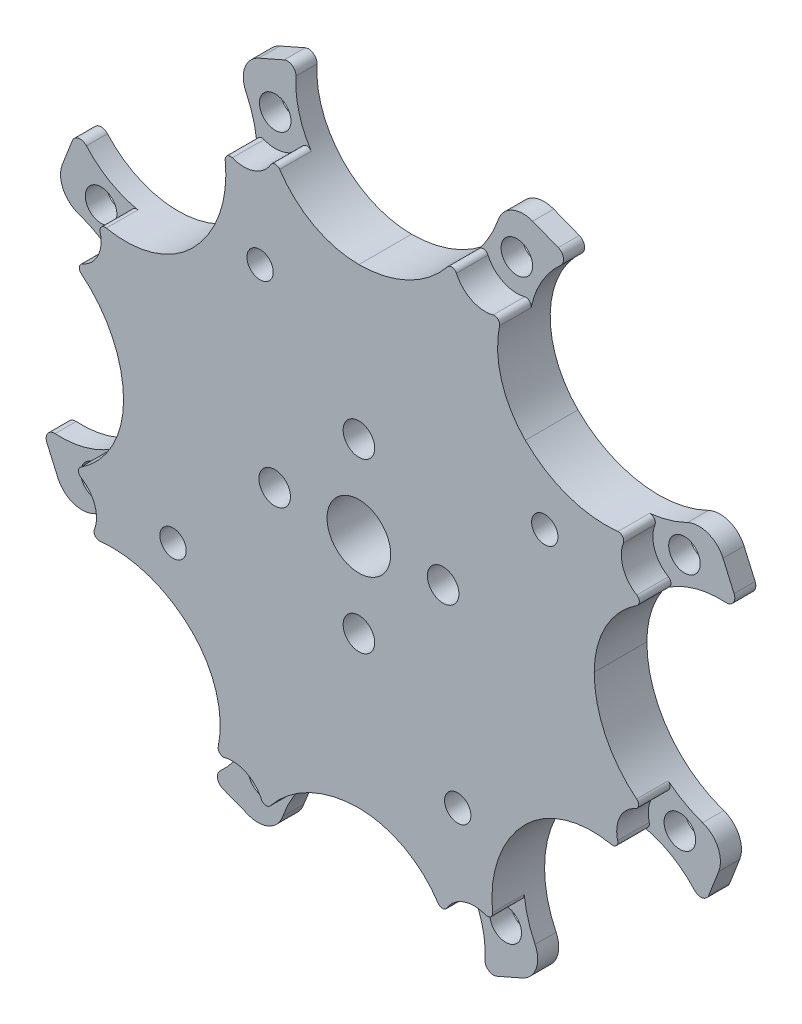
from build123d import *

# Parameters (mm, degrees)
SKETCH_1_R          = 3.025
SKETCH_1_R_2        = 1.5
EXTRUDE_1_DEPTH     = 5
SKETCH_3_R          = 1.5
CUT_EXTRUDE_3_DEPTH = 10
CUT_EXTRUDE_START   = -3
CUT_EXTRUDE_5_DEPTH = 3
FILLET_1_R          = 0.5
HOLE_WIZARD_M3_1_D  = 2.5


with BuildPart() as part:
    # 草图1 → 凸台-拉伸1 (new body)
    with BuildSketch(Plane.XY):
        with BuildLine():
            Line((15.936762996, 30.229618981), (13.50337588, 31.175538906))
            ThreePointArc((13.50337588, 31.175538906), (11.545587701, 31.113280948), (10.233613318, 29.658793469))
            ThreePointArc((10.233613318, 29.658793469), (6.285609854, 24.369935979), (0, 22.357511157))
            ThreePointArc((0, 22.357511157), (-6.541634269, 25.176328334), (-8.985563862, 31.867062025))
            ThreePointArc((-8.985563862, 31.867062025), (-9.328351981, 32.569720668), (-10.106575389, 32.644561759))
            Line((-10.106575389, 32.644561759), (-12.496106314, 31.592763621))
            ThreePointArc((-12.496106314, 31.592763621), (-13.836448588, 30.1643753), (-13.73567661, 28.208191357))
            ThreePointArc((-13.73567661, 28.208191357), (-12.787549636, 21.67674434), (-15.80914775, 15.80914775))
            ThreePointArc((-15.80914775, 15.80914775), (-22.427986442, 13.176718539), (-28.887168794, 16.179662515))
            ThreePointArc((-28.887168794, 16.179662515), (-29.626411288, 16.434129403), (-30.229618981, 15.936762996))
            Line((-30.229618981, 15.936762996), (-31.175538906, 13.50337588))
            ThreePointArc((-31.175538906, 13.50337588), (-31.113280948, 11.545587701), (-29.658793469, 10.233613318))
            ThreePointArc((-29.658793469, 10.233613318), (-24.369935979, 6.285609854), (-22.357511157, 0))
            ThreePointArc((-22.357511157, 0), (-25.176328334, -6.541634269), (-31.867062025, -8.985563862))
            ThreePointArc((-31.867062025, -8.985563862), (-32.569720668, -9.328351981), (-32.644561759, -10.106575389))
            Line((-32.644561759, -10.106575389), (-31.592763621, -12.496106314))
            ThreePointArc((-31.592763621, -12.496106314), (-30.1643753, -13.836448588), (-28.208191357, -13.73567661))
            ThreePointArc((-28.208191357, -13.73567661), (-21.67674434, -12.787549636), (-15.80914775, -15.80914775))
            ThreePointArc((-15.80914775, -15.80914775), (-13.176718539, -22.427986442), (-16.179662515, -28.887168794))
            ThreePointArc((-16.179662515, -28.887168794), (-16.434129403, -29.626411288), (-15.936762996, -30.229618981))
            Line((-15.936762996, -30.229618981), (-13.50337588, -31.175538906))
            ThreePointArc((-13.50337588, -31.175538906), (-11.545587701, -31.113280948), (-10.233613318, -29.658793469))
            ThreePointArc((-10.233613318, -29.658793469), (-6.285609854, -24.369935979), (0, -22.357511157))
            ThreePointArc((0, -22.357511157), (6.541634269, -25.176328334), (8.985563862, -31.867062025))
            ThreePointArc((8.985563862, -31.867062025), (9.328351981, -32.569720668), (10.106575389, -32.644561759))
            Line((10.106575389, -32.644561759), (12.496106314, -31.592763621))
            ThreePointArc((12.496106314, -31.592763621), (13.836448588, -30.1643753), (13.73567661, -28.208191357))
            ThreePointArc((13.73567661, -28.208191357), (12.787549636, -21.67674434), (15.80914775, -15.80914775))
            ThreePointArc((15.80914775, -15.80914775), (22.427986442, -13.176718539), (28.887168794, -16.179662515))
            ThreePointArc((28.887168794, -16.179662515), (29.626411288, -16.434129403), (30.229618981, -15.936762996))
            Line((30.229618981, -15.936762996), (31.175538906, -13.50337588))
            ThreePointArc((31.175538906, -13.50337588), (31.113280948, -11.545587701), (29.658793469, -10.233613318))
            ThreePointArc((29.658793469, -10.233613318), (24.369935979, -6.285609854), (22.357511157, 0))
            ThreePointArc((22.357511157, 0), (25.176328334, 6.541634269), (31.867062025, 8.985563862))
            ThreePointArc((31.867062025, 8.985563862), (32.569720668, 9.328351981), (32.644561759, 10.106575389))
            Line((32.644561759, 10.106575389), (31.592763621, 12.496106314))
            ThreePointArc((31.592763621, 12.496106314), (30.1643753, 13.836448588), (28.208191357, 13.73567661))
            ThreePointArc((28.208191357, 13.73567661), (21.67674434, 12.787549636), (15.80914775, 15.80914775))
            ThreePointArc((15.80914775, 15.80914775), (13.176718539, 22.427986442), (16.179662515, 28.887168794))
            ThreePointArc((16.179662515, 28.887168794), (16.434129403, 29.626411288), (15.936762996, 30.229618981))
        make_face()
        Circle(SKETCH_1_R, mode=Mode.SUBTRACT)
        with Locations((-8, 0)):
            Circle(SKETCH_1_R_2, mode=Mode.SUBTRACT)
        with Locations((0, 8)):
            Circle(SKETCH_1_R_2, mode=Mode.SUBTRACT)
        with Locations((8, 0)):
            Circle(SKETCH_1_R_2, mode=Mode.SUBTRACT)
        with Locations((0, -8)):
            Circle(SKETCH_1_R_2, mode=Mode.SUBTRACT)
    extrude(amount=EXTRUDE_1_DEPTH)

    # 草图3 → 切除-拉伸3 (cut)
    with BuildSketch(Plane.XY.offset(5)):
        with Locations((-10.95008804, 27.930191047)):
            Circle(SKETCH_3_R)
        with Locations((12.006745981, 27.492508997)):
            Circle(SKETCH_3_R)
        with Locations((27.930191047, 10.95008804)):
            Circle(SKETCH_3_R)
        with Locations((27.492508997, -12.006745981)):
            Circle(SKETCH_3_R)
        with Locations((10.95008804, -27.930191047)):
            Circle(SKETCH_3_R)
        with Locations((-12.006745981, -27.492508997)):
            Circle(SKETCH_3_R)
        with Locations((-27.930191047, -10.95008804)):
            Circle(SKETCH_3_R)
        with Locations((-27.492508997, 12.006745981)):
            Circle(SKETCH_3_R)
    extrude(amount=-CUT_EXTRUDE_3_DEPTH, mode=Mode.SUBTRACT)

    # 草图5 → 切除-拉伸5 (cut)
    with BuildSketch(Plane.XY.offset(5).offset(CUT_EXTRUDE_START)):
        with BuildLine():
            Line((15.936762996, 30.229618981), (13.50337588, 31.175538906))
            ThreePointArc((13.50337588, 31.175538906), (11.545587701, 31.113280948), (10.233613318, 29.658793469))
            ThreePointArc((10.233613318, 29.658793469), (9.705394279, 28.391351914), (9.020942987, 27.200994876))
            ThreePointArc((9.020942987, 27.200994876), (10.691803769, 24.796043351), (13.615595197, 24.960394426))
            ThreePointArc((13.615595197, 24.960394426), (14.637360817, 27.093728928), (16.179662515, 28.887168794))
            ThreePointArc((16.179662515, 28.887168794), (16.434129403, 29.626411288), (15.936762996, 30.229618981))
        make_face()
        with BuildLine():
            Line((32.644561759, 10.106575389), (31.592763621, 12.496106314))
            ThreePointArc((31.592763621, 12.496106314), (30.1643753, 13.836448588), (28.208191357, 13.73567661))
            ThreePointArc((28.208191357, 13.73567661), (26.938467574, 13.212967357), (25.612777891, 12.855237973))
            ThreePointArc((25.612777891, 12.855237973), (25.093697348, 9.973203452), (27.277343853, 8.021984466))
            ThreePointArc((27.277343853, 8.021984466), (29.508336545, 8.80798236), (31.867062025, 8.985563862))
            ThreePointArc((31.867062025, 8.985563862), (32.569720668, 9.328351981), (32.644561759, 10.106575389))
        make_face()
        with BuildLine():
            Line((30.229618981, -15.936762996), (31.175538906, -13.50337588))
            ThreePointArc((31.175538906, -13.50337588), (31.113280948, -11.545587701), (29.658793469, -10.233613318))
            ThreePointArc((29.658793469, -10.233613318), (28.391351914, -9.705394279), (27.200994876, -9.020942987))
            ThreePointArc((27.200994876, -9.020942987), (24.796043351, -10.691803769), (24.960394426, -13.615595197))
            ThreePointArc((24.960394426, -13.615595197), (27.093728928, -14.637360817), (28.887168794, -16.179662515))
            ThreePointArc((28.887168794, -16.179662515), (29.626411288, -16.434129403), (30.229618981, -15.936762996))
        make_face()
        with BuildLine():
            Line((10.106575389, -32.644561759), (12.496106314, -31.592763621))
            ThreePointArc((12.496106314, -31.592763621), (13.836448588, -30.1643753), (13.73567661, -28.208191357))
            ThreePointArc((13.73567661, -28.208191357), (13.212967357, -26.938467574), (12.855237973, -25.612777891))
            ThreePointArc((12.855237973, -25.612777891), (9.973203452, -25.093697348), (8.021984466, -27.277343853))
            ThreePointArc((8.021984466, -27.277343853), (8.80798236, -29.508336545), (8.985563862, -31.867062025))
            ThreePointArc((8.985563862, -31.867062025), (9.328351981, -32.569720668), (10.106575389, -32.644561759))
        make_face()
        with BuildLine():
            Line((-15.936762996, -30.229618981), (-13.50337588, -31.175538906))
            ThreePointArc((-13.50337588, -31.175538906), (-11.545587701, -31.113280948), (-10.233613318, -29.658793469))
            ThreePointArc((-10.233613318, -29.658793469), (-9.705394279, -28.391351914), (-9.020942987, -27.200994876))
            ThreePointArc((-9.020942987, -27.200994876), (-10.691803769, -24.796043351), (-13.615595197, -24.960394426))
            ThreePointArc((-13.615595197, -24.960394426), (-14.637360817, -27.093728928), (-16.179662515, -28.887168794))
            ThreePointArc((-16.179662515, -28.887168794), (-16.434129403, -29.626411288), (-15.936762996, -30.229618981))
        make_face()
        with BuildLine():
            Line((-32.644561759, -10.106575389), (-31.592763621, -12.496106314))
            ThreePointArc((-31.592763621, -12.496106314), (-30.1643753, -13.836448588), (-28.208191357, -13.73567661))
            ThreePointArc((-28.208191357, -13.73567661), (-26.938467574, -13.212967357), (-25.612777891, -12.855237973))
            ThreePointArc((-25.612777891, -12.855237973), (-25.093697348, -9.973203452), (-27.277343853, -8.021984466))
            ThreePointArc((-27.277343853, -8.021984466), (-29.508336545, -8.80798236), (-31.867062025, -8.985563862))
            ThreePointArc((-31.867062025, -8.985563862), (-32.569720668, -9.328351981), (-32.644561759, -10.106575389))
        make_face()
        with BuildLine():
            Line((-30.229618981, 15.936762996), (-31.175538906, 13.50337588))
            ThreePointArc((-31.175538906, 13.50337588), (-31.113280948, 11.545587701), (-29.658793469, 10.233613318))
            ThreePointArc((-29.658793469, 10.233613318), (-28.391351914, 9.705394279), (-27.200994876, 9.020942987))
            ThreePointArc((-27.200994876, 9.020942987), (-24.796043351, 10.691803769), (-24.960394426, 13.615595197))
            ThreePointArc((-24.960394426, 13.615595197), (-27.093728928, 14.637360817), (-28.887168794, 16.179662515))
            ThreePointArc((-28.887168794, 16.179662515), (-29.626411288, 16.434129403), (-30.229618981, 15.936762996))
        make_face()
        with BuildLine():
            Line((-10.106575389, 32.644561759), (-12.496106314, 31.592763621))
            ThreePointArc((-12.496106314, 31.592763621), (-13.836448588, 30.1643753), (-13.73567661, 28.208191357))
            ThreePointArc((-13.73567661, 28.208191357), (-13.212967357, 26.938467574), (-12.855237973, 25.612777891))
            ThreePointArc((-12.855237973, 25.612777891), (-9.973203452, 25.093697348), (-8.021984466, 27.277343853))
            ThreePointArc((-8.021984466, 27.277343853), (-8.80798236, 29.508336545), (-8.985563862, 31.867062025))
            ThreePointArc((-8.985563862, 31.867062025), (-9.328351981, 32.569720668), (-10.106575389, 32.644561759))
        make_face()
    extrude(amount=CUT_EXTRUDE_5_DEPTH, mode=Mode.SUBTRACT)

    # 圆角1
    fillet_1_edges = [part.edges().sort_by_distance(p)[0] for p in [
        (27.277343853, 8.021984466, 3.5),
        (25.612777891, 12.855237973, 3.5),
        (24.960394426, -13.615595197, 3.5),
        (27.200994876, -9.020942987, 3.5),
        (8.021984466, -27.277343853, 3.5),
        (12.855237973, -25.612777891, 3.5),
        (-13.615595197, -24.960394426, 3.5),
        (-9.020942987, -27.200994876, 3.5),
        (-27.277343853, -8.021984466, 3.5),
        (-25.612777891, -12.855237973, 3.5),
        (-24.960394426, 13.615595197, 3.5),
        (-27.200994876, 9.020942987, 3.5),
        (-8.021984466, 27.277343853, 3.5),
        (-12.855237973, 25.612777891, 3.5),
        (13.615595197, 24.960394426, 3.5),
        (9.020942987, 27.200994876, 3.5),
    ]]
    fillet(fillet_1_edges, radius=FILLET_1_R)

    # M3 螺纹孔1 (through all)
    with Locations(Plane.XY.offset(5)):
        with Locations((0, 0), (-17.658951857, -9.389431256), (-9.389431256, 17.658951857), (17.658951857, 9.389431256), (9.389431256, -17.658951857)):
            Hole(HOLE_WIZARD_M3_1_D / 2)


solid = part.part
